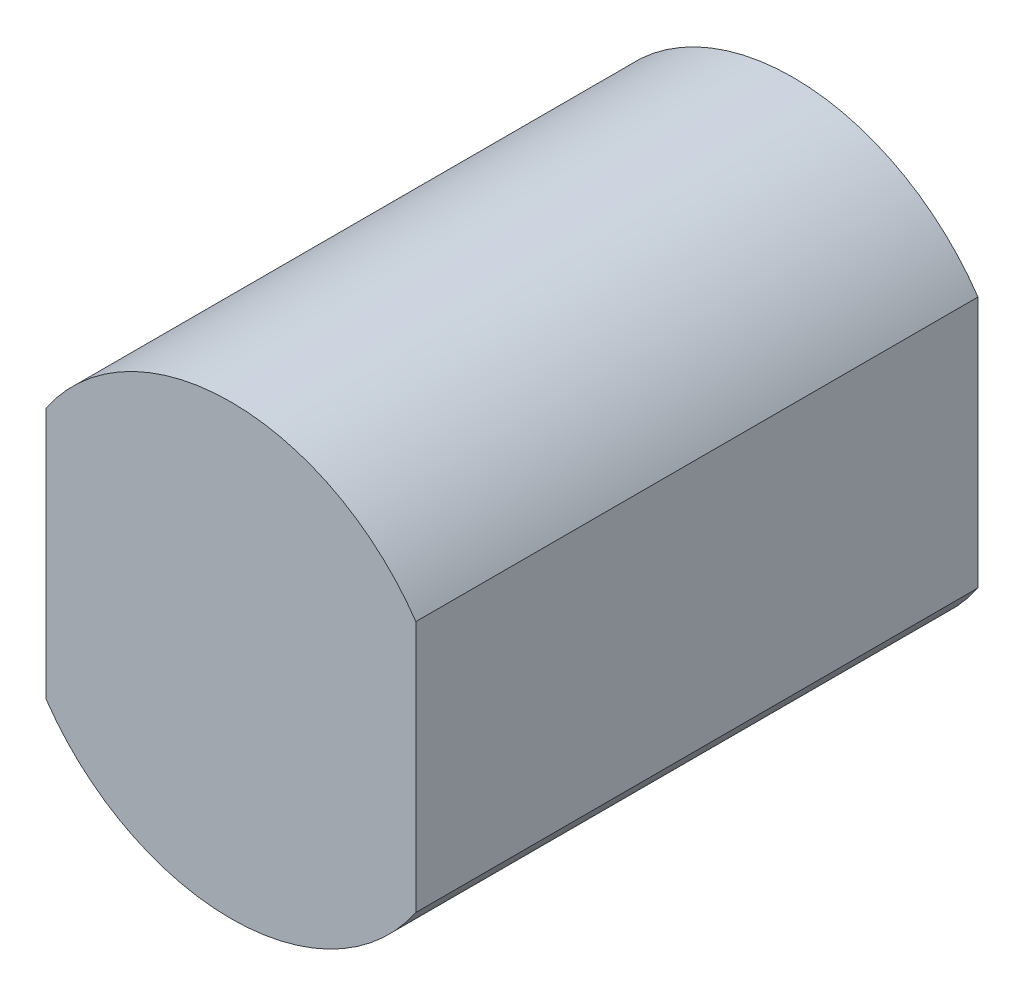
from build123d import *

# Parameters (mm, degrees)
EXTRUDE_1_DEPTH = 15.2


with BuildPart() as part:
    # 草图1 → 凸台-拉伸1 (new body)
    with BuildSketch(Plane.XY):
        with BuildLine():
            Line((-5, -3.406244266), (-5, 3.406244266))
            ThreePointArc((-5, 3.406244266), (0, 6.05), (5, 3.406244266))
            Line((5, 3.406244266), (5, -3.406244266))
            ThreePointArc((5, -3.406244266), (0, -6.05), (-5, -3.406244266))
        make_face()
    extrude(amount=EXTRUDE_1_DEPTH)


solid = part.part
